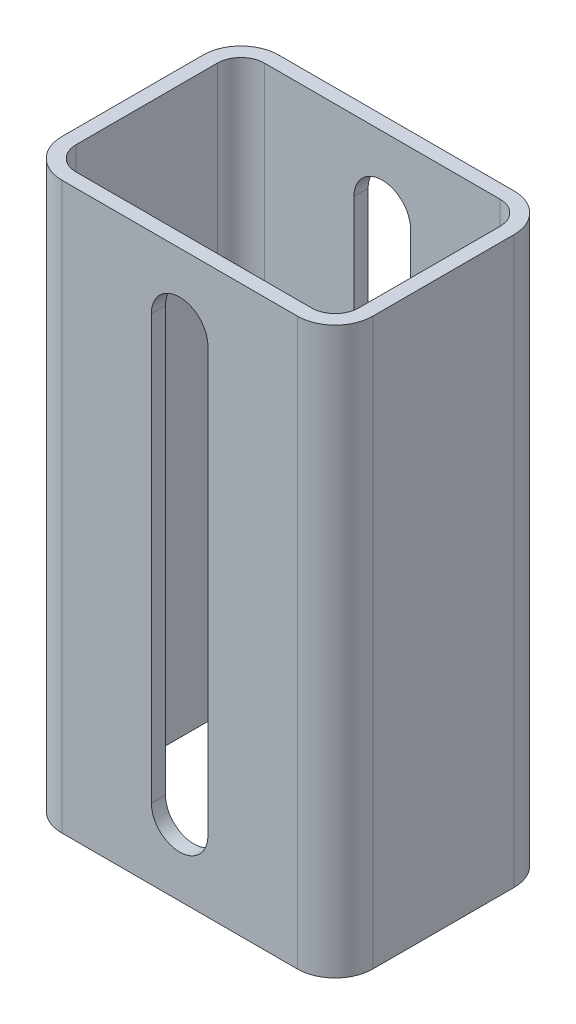
from build123d import *

# Parameters (mm, degrees)
EXTRUDE_THIN1_DEPTH     = 60
CUT_EXTRUDE1_DEPTH      = 83.492423895
CUT_EXTRUDE1_DEPTH_BACK = 83.492423895


with BuildPart() as part:
    # Sketch1 → Extrude-Thin1 (new, symmetric)
    with BuildSketch(Plane(origin=(0, 0, 0), x_dir=(1, 0, 0), z_dir=(0, 1, 0))):
        with BuildLine():
            Line((25, 23), (-25, 23))
            ThreePointArc((-25, 23), (-30.656854249, 20.656854249), (-33, 15))
            Line((-33, 15), (-33, -15))
            ThreePointArc((-33, -15), (-30.656854249, -20.656854249), (-25, -23))
            Line((-25, -23), (25, -23))
            ThreePointArc((25, -23), (30.656854249, -20.656854249), (33, -15))
            Line((33, -15), (33, 15))
            ThreePointArc((33, 15), (30.656854249, 20.656854249), (25, 23))
        make_face()
        with BuildLine():
            Line((25, 20), (-25, 20))
            ThreePointArc((-25, 20), (-28.535533906, 18.535533906), (-30, 15))
            Line((-30, 15), (-30, -15))
            ThreePointArc((-30, -15), (-28.535533906, -18.535533906), (-25, -20))
            Line((-25, -20), (25, -20))
            ThreePointArc((25, -20), (28.535533906, -18.535533906), (30, -15))
            Line((30, -15), (30, 15))
            ThreePointArc((30, 15), (28.535533906, 18.535533906), (25, 20))
        make_face(mode=Mode.SUBTRACT)
    extrude(amount=EXTRUDE_THIN1_DEPTH, both=True)

    # Sketch2 → Cut-Extrude1 (cut, two sides: drawn at the far end of the back side and taken through both)
    with BuildSketch(Plane.XY.offset(23).offset(-CUT_EXTRUDE1_DEPTH_BACK)):
        with BuildLine():
            Line((6, 45), (6, -45))
            ThreePointArc((6, -45), (0, -51), (-6, -45))
            Line((-6, -45), (-6, 45))
            ThreePointArc((-6, 45), (0, 51), (6, 45))
        make_face()
    extrude(amount=CUT_EXTRUDE1_DEPTH + CUT_EXTRUDE1_DEPTH_BACK, mode=Mode.SUBTRACT)


solid = part.part
